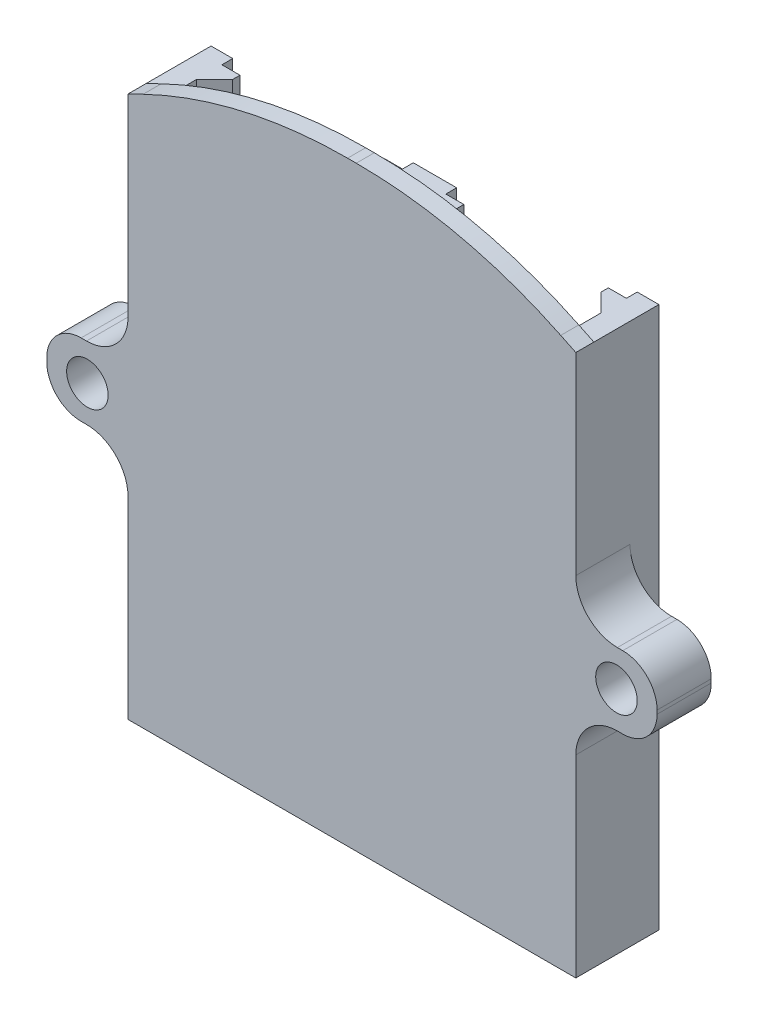
from build123d import *

# Parameters (mm, degrees)
P_IDAT_VYSUNUT_M1_DEPTH = 30
P_IDAT_START            = -2
SKICA2_R                = 1.15
P_IDAT_VYSUNUT_M2_DEPTH = 3
P_IDAT_VYSUNUT_M3_DEPTH = 1


with BuildPart() as part:
    # Skica1 → Přidat vysunutím1 (new body)
    with BuildSketch(Plane(origin=(0, 0, 0), x_dir=(1, 0, 0), z_dir=(0, 1, 0))):
        Polygon((-5, 0), (5, 0), (5, 1.6), (4, 2.6), (4, 3), (5, 3), (5, 3.6), (6.2, 3.6), (6.2, -1), (-6.2, -1), (-6.2, 3.6), (-5, 3.6), (-5, 3), (-4, 3), (-4, 2.6), (-5, 1.6), align=None)
    p_idat_vysunut_m1 = extrude(amount=P_IDAT_VYSUNUT_M1_DEPTH)

    # Skica2 → Přidat vysunutím2 (add)
    with BuildSketch(Plane.XY.offset(P_IDAT_START)):
        with BuildLine():
            Line((-8.8, 13), (-8.5, 13))
            ThreePointArc((-8.5, 13), (-6.873654403, 12.326345597), (-6.2, 10.7))
            Line((-6.2, 10.7), (-6.2, 13))
            Line((-6.2, 13), (-6.2, 17))
            Line((-6.2, 17), (-6.2, 19.3))
            ThreePointArc((-6.2, 19.3), (-6.873654403, 17.673654403), (-8.5, 17))
            Line((-8.5, 17), (-8.8, 17))
            ThreePointArc((-8.8, 17), (-10.143502884, 16.443502884), (-10.7, 15.1))
            Line((-10.7, 15.1), (-10.7, 14.9))
            ThreePointArc((-10.7, 14.9), (-10.143502884, 13.556497116), (-8.8, 13))
        make_face()
        with Locations((-8.45, 15)):
            Circle(SKICA2_R, mode=Mode.SUBTRACT)
    p_idat_vysunut_m2 = extrude(amount=P_IDAT_VYSUNUT_M2_DEPTH)

    # Skica3 → Přidat vysunutím3 (add)
    with BuildSketch(Plane.XY.offset(1)):
        with BuildLine():
            Line((-6.2, 30), (6.2, 30))
            Line((6.2, 30), (6.2, 33))
            Line((6.2, 33), (5.959807907, 33))
            ThreePointArc((5.959807907, 33), (0.150662271, 32.3427273), (-5.364776224, 30.404140537))
            Line((-5.364776224, 30.404140537), (-6.2, 30))
        make_face()
    p_idat_vysunut_m3 = extrude(amount=-P_IDAT_VYSUNUT_M3_DEPTH)

    # Zrcadlit2: Přidat vysunutím1, Přidat vysunutím2, Přidat vysunutím3 across plane
    add(p_idat_vysunut_m1.mirror(Plane(origin=(6.2, 30, -3.6), x_dir=(0, 0, 1), z_dir=(-1, 0, 0))))
    add(p_idat_vysunut_m2.mirror(Plane(origin=(6.2, 30, -3.6), x_dir=(0, 0, 1), z_dir=(-1, 0, 0))))
    add(p_idat_vysunut_m3.mirror(Plane(origin=(6.2, 30, -3.6), x_dir=(0, 0, 1), z_dir=(-1, 0, 0))))


solid = part.part
